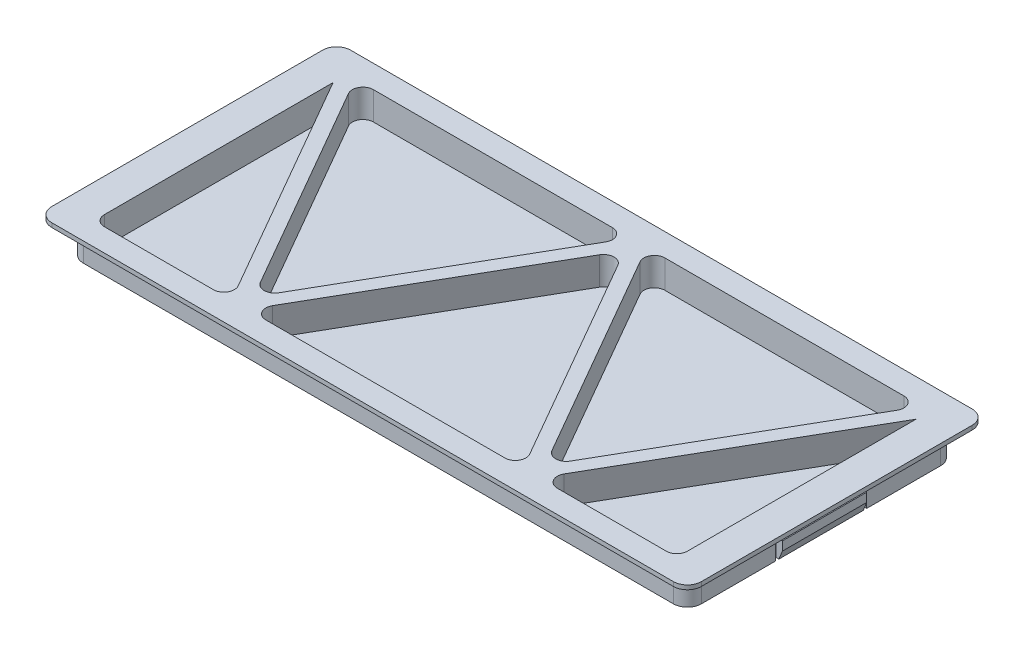
from build123d import *

# Parameters (mm, degrees)
SKETCH1_W           = 88.1
SKETCH1_H           = 38.1
BOSS_EXTRUDE1_DEPTH = 5
SHELL1_T            = -1
SKETCH2_W           = 92.6
SKETCH2_H           = 42.6
SKETCH2_W_2         = 88.1
SKETCH2_H_2         = 38.1
BOSS_EXTRUDE2_DEPTH = 0.6
SKETCH5_W           = 2.5
SKETCH5_H           = 38.1
BOSS_EXTRUDE4_DEPTH = 5
SKETCH7_W           = 2
SKETCH7_H           = 13.01498231
CUT_EXTRUDE2_DEPTH  = 4.4
SKETCH8_W           = 0.4
SKETCH8_H           = 12.02996462
BOSS_EXTRUDE5_DEPTH = 4.4
BOSS_EXTRUDE6_DEPTH = 12.02996462
BOSS_EXTRUDE3_DEPTH = 4
SKETCH4_W           = 88.1
SKETCH4_H           = 100
CUT_EXTRUDE1_DEPTH  = 4.4
FILLET1_R           = 2
FILLET2_R           = 1.5


with BuildPart() as part:
    # Sketch1 → Boss-Extrude1 (new body)
    with BuildSketch(Plane(origin=(0, 0, 0), x_dir=(1, 0, 0), z_dir=(0, 1, 0))):
        Rectangle(SKETCH1_W, SKETCH1_H)
    extrude(amount=BOSS_EXTRUDE1_DEPTH)

    # Shell1
    shell1_openings = [part.faces().sort_by_distance(p)[0] for p in [
        (0, 5, 0),
    ]]
    offset(amount=SHELL1_T, openings=shell1_openings, kind=Kind.INTERSECTION)

    # Sketch2 → Boss-Extrude2 (add)
    with BuildSketch(Plane(origin=(0, 5, 0), x_dir=(1, 0, 0), z_dir=(0, 1, 0))):
        Rectangle(SKETCH2_W, SKETCH2_H)
        Rectangle(SKETCH2_W_2, SKETCH2_H_2, mode=Mode.SUBTRACT)
    extrude(amount=-BOSS_EXTRUDE2_DEPTH)

    # Sketch5 → Boss-Extrude4 (add)
    with BuildSketch(Plane.XZ):
        with Locations((42.8, 0)):
            Rectangle(SKETCH5_W, SKETCH5_H)
    boss_extrude4 = extrude(amount=-BOSS_EXTRUDE4_DEPTH)

    # Sketch7 → Cut-Extrude2 (cut)
    with BuildSketch(Plane.XZ):
        with Locations((43.05, 0.007491155)):
            Rectangle(SKETCH7_W, SKETCH7_H)
    cut_extrude2 = extrude(amount=-CUT_EXTRUDE2_DEPTH, mode=Mode.SUBTRACT)

    # Sketch8 → Boss-Extrude5 (add)
    with BuildSketch(Plane.XZ.offset(-4.4)):
        with Locations((43.85, 0)):
            Rectangle(SKETCH8_W, SKETCH8_H)
    boss_extrude5 = extrude(amount=BOSS_EXTRUDE5_DEPTH)

    # Sketch9 → Boss-Extrude6 (add)
    with BuildSketch(Plane(origin=(0, 0, -6.01498231), x_dir=(-1, 0, 0), z_dir=(0, 0, -1))):
        Polygon((-44.05, 0), (-44.55, 1.237543427), (-44.55, 2.5), (-44.05, 2.5), align=None)
    boss_extrude6 = extrude(amount=-BOSS_EXTRUDE6_DEPTH)

    # Mirror1: Boss-Extrude4, Cut-Extrude2, Boss-Extrude5, Boss-Extrude6 across plane
    add(boss_extrude4.mirror(Plane(origin=(0, 0, 0), x_dir=(0, 0, 1), z_dir=(1, 0, 0))))
    add(cut_extrude2.mirror(Plane(origin=(0, 0, 0), x_dir=(0, 0, 1), z_dir=(1, 0, 0))), mode=Mode.SUBTRACT)
    add(boss_extrude5.mirror(Plane(origin=(0, 0, 0), x_dir=(0, 0, 1), z_dir=(1, 0, 0))))
    add(boss_extrude6.mirror(Plane(origin=(0, 0, 0), x_dir=(0, 0, 1), z_dir=(1, 0, 0))))

    # Sketch3 → Boss-Extrude3 (add)
    with BuildSketch(Plane(origin=(0, 5, 0), x_dir=(1, 0, 0), z_dir=(0, 1, 0))):
        Polygon((-42.416724684, 17.551213149), (-20.775, -20.0548644), (0, 16.0451356), (20.775, -20.0548644), (42.416724684, 17.551213149), (40.683275316, 18.548786851), (20.775, -16.0451356), (0, 20.0548644), (-20.775, -16.0451356), (-40.683275316, 18.548786851), align=None)
    extrude(amount=-BOSS_EXTRUDE3_DEPTH)

    # Sketch4 → Cut-Extrude1 (cut)
    with BuildSketch(Plane.XZ):
        with Locations((0, 69.05)):
            Rectangle(SKETCH4_W, SKETCH4_H)
        with Locations((0, -69.05)):
            Rectangle(SKETCH4_W, SKETCH4_H)
    extrude(amount=-CUT_EXTRUDE1_DEPTH, mode=Mode.SUBTRACT)

    # Fillet1
    fillet1_edges = [part.edges().sort_by_distance(p)[0] for p in [
        (-44.05, 2.2, -19.05),
        (44.05, 2.2, -19.05),
        (44.05, 2.2, 19.05),
        (-44.05, 2.2, 19.05),
        (-46.3, 4.7, -21.3),
        (46.3, 4.7, -21.3),
        (46.3, 4.7, 21.3),
        (-46.3, 4.7, 21.3),
    ]]
    fillet(fillet1_edges, radius=FILLET1_R)

    # Fillet2
    fillet2_edges = [part.edges().sort_by_distance(p)[0] for p in [
        (-41.55, 3, 18.05),
        (-21.928768917, 3, 18.05),
        (-40.396231083, 3, -18.05),
        (-1.153768917, 3, -18.05),
        (-20.775, 3, 16.0451356),
        (1.153768917, 3, -18.05),
        (40.396231083, 3, -18.05),
        (20.775, 3, 16.0451356),
        (21.928768917, 3, 18.05),
        (19.621231083, 3, 18.05),
        (-19.621231083, 3, 18.05),
        (0, 3, -16.0451356),
        (41.55, 3, 18.05),
    ]]
    fillet(fillet2_edges, radius=FILLET2_R)


solid = part.part
